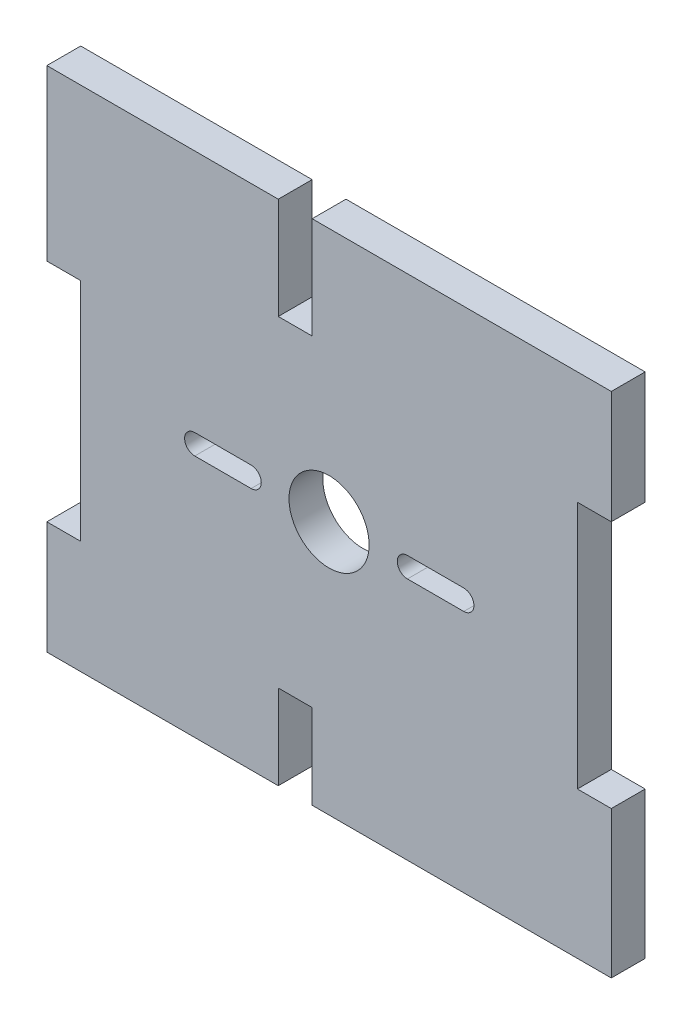
from build123d import *

# Parameters (mm, degrees)
SKETCH_1_R      = 3.55
EXTRUDE_1_DEPTH = 3


with BuildPart() as part:
    # 草图1 → 凸台-拉伸1 (new body)
    with BuildSketch(Plane.XY.offset(3)):
        Polygon((19.632388504, 35.9998), (16.632358504, 35.9998), (16.632358504, 44.9999), (-3.867371496, 44.9999), (-3.867371496, 29.9998), (-0.867341496, 29.9998), (-0.867341496, 9.9991), (-3.867371496, 9.9991), (-3.867371496, 0), (16.632358504, 0), (16.632358504, 7.4993), (19.632388504, 7.4993), (19.632388504, 0), (46.131858504, 0), (46.131858504, 13.0005), (43.131858504, 13.0005), (43.131858504, 34.9994), (46.131858504, 34.9994), (46.131858504, 44.9999), (19.632388504, 44.9999), align=None)
        with Locations(Location((21.131658504, 22.4992, 0), (0, 0, 180))):
            Circle(SKETCH_1_R, mode=Mode.SUBTRACT)
        with BuildLine():
            Line((28.074484618, 23.3866), (33.064389495, 23.3866))
            ThreePointArc((33.064389495, 23.3866), (33.964139495, 22.48685), (33.064389495, 21.5871))
            Line((33.064389495, 21.5871), (28.074484618, 21.5871))
            ThreePointArc((28.074484618, 21.5871), (27.174734618, 22.48685), (28.074484618, 23.3866))
        make_face(mode=Mode.SUBTRACT)
        with BuildLine():
            Line((14.226589495, 21.5995), (9.236684618, 21.5995))
            ThreePointArc((9.236684618, 21.5995), (8.336934618, 22.49925), (9.236684618, 23.399))
            Line((9.236684618, 23.399), (14.226589495, 23.399))
            ThreePointArc((14.226589495, 23.399), (15.126339495, 22.49925), (14.226589495, 21.5995))
        make_face(mode=Mode.SUBTRACT)
    extrude(amount=-EXTRUDE_1_DEPTH)


solid = part.part
